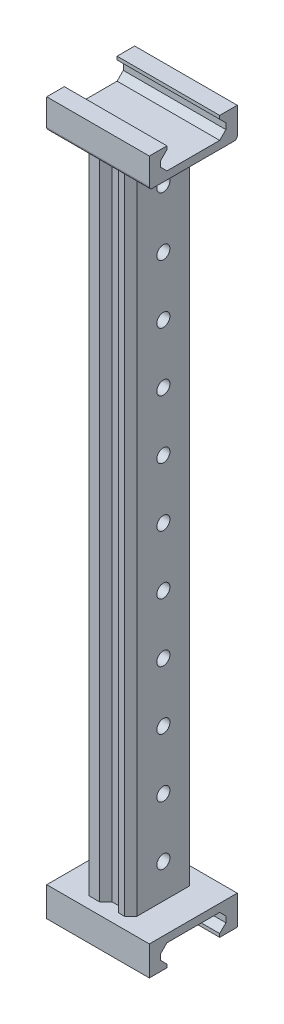
from build123d import *

# Parameters (mm, degrees)
BOSS_EXTRUDE1_DEPTH = 35
FILLET1_R           = 1
BOSS_EXTRUDE2_DEPTH = 222.716603748
SKETCH6_R           = 2.238154979
CUT_EXTRUDE1_DEPTH  = 15.286677324


with BuildPart() as part:
    # Sketch1 → Boss-Extrude1 (new body)
    with BuildSketch(Plane.YZ):
        Polygon((60.116092999, 26.392150669), (61.250815122, 26.392150669), (61.250815122, 32.392150669), (51.18048308, 32.392150669), (51.18048308, 2.389198142), (61.250815122, 2.389198142), (61.250815122, 8.389198142), (60.116092999, 8.389198142), (57.992886952, 6.265992095), (55.985387253, 6.265992095), (53.862181206, 8.389198142), (53.862181206, 26.392150669), (55.985387253, 28.515356716), (57.992886952, 28.515356716), align=None)
    extrude(amount=BOSS_EXTRUDE1_DEPTH)


with BuildPart() as body_2:
    # Mirror4: mirrored copy
    add(part.part.mirror(Plane.ZX.offset(-60.177818794)))


with BuildPart() as part_1:
    add(part.part)

    # Fillet1
    fillet1_edges = [part_1.edges().sort_by_distance(p)[0] for p in [
        (17.5, 51.18048308, 2.389198142),
        (17.5, 51.18048308, 32.392150669),
    ]]
    fillet(fillet1_edges, radius=FILLET1_R)

    add(body_2.part)  # Boss-Extrude2 merges body 2
    # Sketch3 → Boss-Extrude2 (add)
    with BuildSketch(Plane.XZ.offset(-51.18048308)):
        Polygon((24.733095029, 8.333793818), (24.733095029, 26.336746345), (22.609888982, 28.459952392), (20.602389284, 28.459952392), (18.479183237, 26.336746345), (16.20973899, 26.336746345), (14.086532943, 28.459952392), (10.508020729, 28.459952392), (9.446417705, 27.398349369), (9.446417705, 19.57342506), (10.508020729, 18.511822037), (10.508020729, 16.158718126), (9.446417705, 15.097115103), (9.446417705, 7.272190794), (10.508020729, 6.210587771), (14.086532943, 6.210587771), (16.20973899, 8.333793818), (18.479183237, 8.333793818), (20.602389284, 6.210587771), (22.609888982, 6.210587771), align=None)
    extrude(amount=BOSS_EXTRUDE2_DEPTH)

    # Sketch6 → Cut-Extrude1 (cut)
    with BuildSketch(Plane(origin=(9.446417705, 0, 0), x_dir=(0, -1, 0), z_dir=(-1, 0, 0))):
        with Locations(Location((159.829006886, 17.335270082, 0), (0, 0, 90))):
            Circle(SKETCH6_R)
        with Locations(Location((139.829006886, 17.335270082, 0), (0, 0, 90))):
            Circle(SKETCH6_R)
        with Locations(Location((119.829006886, 17.335270082, 0), (0, 0, 90))):
            Circle(SKETCH6_R)
        with Locations(Location((99.829006886, 17.335270082, 0), (0, 0, 90))):
            Circle(SKETCH6_R)
        with Locations(Location((79.829006886, 17.335270082, 0), (0, 0, 90))):
            Circle(SKETCH6_R)
        with Locations(Location((59.829006886, 17.335270082, 0), (0, 0, 90))):
            Circle(SKETCH6_R)
        with Locations(Location((39.829006886, 17.335270082, 0), (0, 0, 90))):
            Circle(SKETCH6_R)
        with Locations(Location((19.829006886, 17.335270082, 0), (0, 0, 90))):
            Circle(SKETCH6_R)
        with Locations(Location((-0.170993114, 17.335270082, 0), (0, 0, 90))):
            Circle(SKETCH6_R)
        with Locations(Location((-20.170993114, 17.335270082, 0), (0, 0, 90))):
            Circle(SKETCH6_R)
        with Locations(Location((-40.170993114, 17.335270082, 0), (0, 0, 90))):
            Circle(SKETCH6_R)
    extrude(amount=-CUT_EXTRUDE1_DEPTH, mode=Mode.SUBTRACT)


solid = part_1.part
